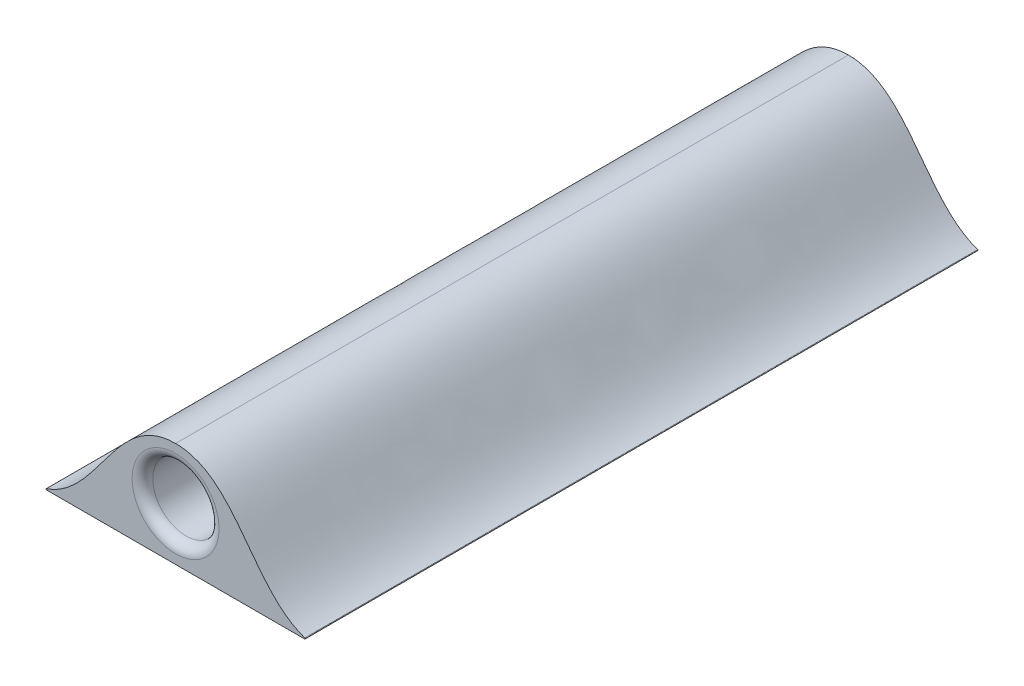
from build123d import *

# Parameters (mm, degrees)
SKETCH1_R           = 1.625
BOSS_EXTRUDE1_DEPTH = 33
SKETCH2_W           = 10.714
SKETCH2_H           = 30.714
CUT_EXTRUDE1_DEPTH  = 0.5
FILLET1_R           = 0.0254
FILLET2_R           = 0.508


with BuildPart() as part:
    # Sketch1 → Boss-Extrude1 (new body)
    with BuildSketch(Plane.XY):
        with BuildLine():
            Line((-6.5, -2.585227273), (6.5, -2.585227273))
            add(Edge.make_bspline(
                [(6.5, -2.585227273), (3.76067286, -1.82815341), (3.036661759, 2.555681818), (0, 2.555681818)],
                knots=[0, 0, 0, 0, 1, 1, 1, 1], degree=3))
            add(Edge.make_bspline(
                [(-6.5, -2.585227273), (-3.76067286, -1.82815341), (-3.036661759, 2.555681818), (0, 2.555681818)],
                knots=[0, 0, 0, 0, 1, 1, 1, 1], degree=3))
        make_face()
        Circle(SKETCH1_R, mode=Mode.SUBTRACT)
    extrude(amount=BOSS_EXTRUDE1_DEPTH)

    # Sketch2 → Cut-Extrude1 (cut)
    with BuildSketch(Plane.XZ.offset(2.585227273)):
        with Locations((0, 16.5)):
            Rectangle(SKETCH2_W, SKETCH2_H)
    extrude(amount=-CUT_EXTRUDE1_DEPTH, mode=Mode.SUBTRACT)

    # Fillet1
    fillet1_edges = [part.edges().sort_by_distance(p)[0] for p in [
        (-6.5, -2.585227273, 16.5),
        (6.5, -2.585227273, 16.5),
    ]]
    fillet(fillet1_edges, radius=FILLET1_R)

    # Fillet2
    fillet2_edges = [part.edges().sort_by_distance(p)[0] for p in [
        (-1.625, 0, 0),
        (-1.625, 0, 33),
    ]]
    fillet(fillet2_edges, radius=FILLET2_R)


solid = part.part
